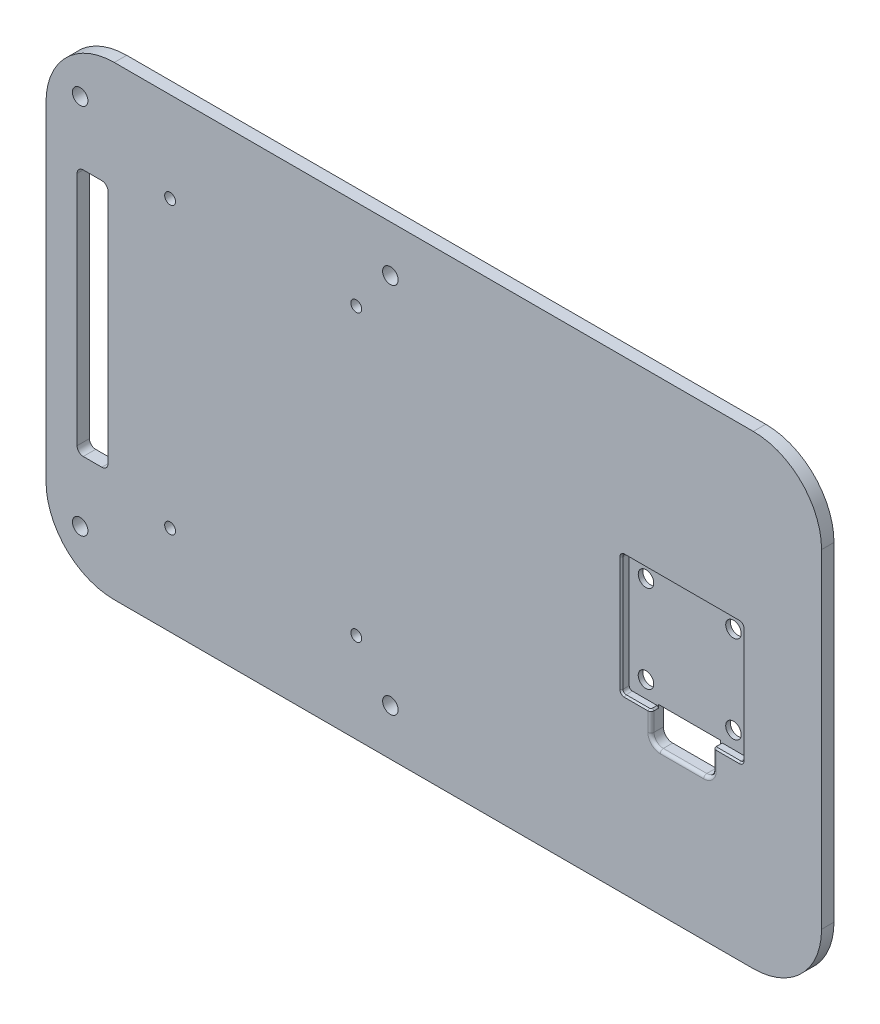
from build123d import *

# Parameters (mm, degrees)
SKETCH_1_R          = 2.5
SKETCH_1_R_2        = 1.75
SKETCH_1_W          = 20
SKETCH_1_H          = 10
EXTRUDE_1_DEPTH     = 4
SKETCH_2_W          = 39
SKETCH_2_H          = 39
CUT_EXTRUDE_1_DEPTH = 2.5
FILLET_1_R          = 3
FILLET_2_R          = 1
CHAMFER_1_SIZE      = 0.5
SKETCH_4_R          = 2.5
CUT_EXTRUDE_2_DEPTH = 2


with BuildPart() as part:
    # 草图1 → 凸台-拉伸1 (new body)
    with BuildSketch(Plane.XY):
        with BuildLine():
            Line((-103, -75), (103, -75))
            ThreePointArc((103, -75), (118.556349186, -68.556349186), (125, -53))
            Line((125, -53), (125, 53))
            ThreePointArc((125, 53), (118.556349186, 68.556349186), (103, 75))
            Line((103, 75), (-103, 75))
            ThreePointArc((-103, 75), (-118.556349186, 68.556349186), (-125, 53))
            Line((-125, 53), (-125, -53))
            ThreePointArc((-125, -53), (-118.556349186, -68.556349186), (-103, -75))
        make_face()
        with Locations((-114, 60)):
            Circle(SKETCH_1_R, mode=Mode.SUBTRACT)
        with Locations(Location((-114, -60, 0), (0, 0, 180))):
            Circle(SKETCH_1_R, mode=Mode.SUBTRACT)
        with Locations((-14, -60)):
            Circle(SKETCH_1_R, mode=Mode.SUBTRACT)
        with Locations(Location((-14, 60, 0), (0, 0, 180))):
            Circle(SKETCH_1_R, mode=Mode.SUBTRACT)
        with Locations((-85, 46)):
            Circle(SKETCH_1_R_2, mode=Mode.SUBTRACT)
        with Locations(Location((-25, 46, 0), (0, 0, 180))):
            Circle(SKETCH_1_R_2, mode=Mode.SUBTRACT)
        with Locations((-25, -46)):
            Circle(SKETCH_1_R_2, mode=Mode.SUBTRACT)
        with Locations(Location((-85, -46, 0), (0, 0, 180))):
            Circle(SKETCH_1_R_2, mode=Mode.SUBTRACT)
        with BuildLine():
            Line((-113, -40), (-107, -40))
            ThreePointArc((-107, -40), (-105.585786438, -39.414213562), (-105, -38))
            Line((-105, -38), (-105, 38))
            ThreePointArc((-105, 38), (-105.585786438, 39.414213562), (-107, 40))
            Line((-107, 40), (-113, 40))
            ThreePointArc((-113, 40), (-114.414213562, 39.414213562), (-115, 38))
            Line((-115, 38), (-115, -38))
            ThreePointArc((-115, -38), (-114.414213562, -39.414213562), (-113, -40))
        make_face(mode=Mode.SUBTRACT)
        with Locations((80, -24)):
            Rectangle(SKETCH_1_W, SKETCH_1_H, mode=Mode.SUBTRACT)
    extrude(amount=EXTRUDE_1_DEPTH)

    # 草图2 → 切除-拉伸1 (cut)
    with BuildSketch(Plane.XY.offset(4)):
        with Locations((80, 0)):
            Rectangle(SKETCH_2_W, SKETCH_2_H)
    extrude(amount=-CUT_EXTRUDE_1_DEPTH, mode=Mode.SUBTRACT)

    # 圆角1
    fillet_1_edges = [part.edges().sort_by_distance(p)[0] for p in [
        (90, -29, 2),
        (70, -29, 2),
    ]]
    fillet(fillet_1_edges, radius=FILLET_1_R)

    # 圆角2
    fillet_2_edges = [part.edges().sort_by_distance(p)[0] for p in [
        (70, -22.75, 4),
        (99.5, -19.5, 2.75),
        (99.5, 19.5, 2.75),
        (60.5, -19.5, 2.75),
        (60.5, 19.5, 2.75),
        (80, -29, 4),
        (90, -22.75, 4),
        (89.121320344, -28.121320344, 4),
        (70.878679656, -28.121320344, 4),
    ]]
    fillet(fillet_2_edges, radius=FILLET_2_R)

    # 倒角1
    chamfer_1_edges = [part.edges().sort_by_distance(p)[0] for p in [
        (90, -19.5, 2.25),
        (70, -19.5, 2.25),
        (99.5, 0, 4),
        (94.75, -19.5, 4),
        (65.25, -19.5, 4),
        (60.5, 0, 4),
        (80, 19.5, 4),
        (69.707106781, -19.5, 3.707106781),
        (90.292893219, -19.5, 3.707106781),
        (60.792893219, -19.207106781, 4),
        (99.207106781, -19.207106781, 4),
        (99.207106781, 19.207106781, 4),
        (60.792893219, 19.207106781, 4),
    ]]
    chamfer(chamfer_1_edges, length=CHAMFER_1_SIZE)

    # 草图4 → 切除-拉伸2 (cut)
    with BuildSketch(Plane.XY.offset(1.5)):
        with Locations((65.900290783, -14.099709217)):
            Circle(SKETCH_4_R)
        with Locations(Location((94.099709217, -14.099709217, 0), (0, 0, 180))):
            Circle(SKETCH_4_R)
        with Locations((94.099709217, 14.099709217)):
            Circle(SKETCH_4_R)
        with Locations(Location((65.900290783, 14.099709217, 0), (0, 0, 180))):
            Circle(SKETCH_4_R)
    extrude(amount=-CUT_EXTRUDE_2_DEPTH, mode=Mode.SUBTRACT)


solid = part.part
